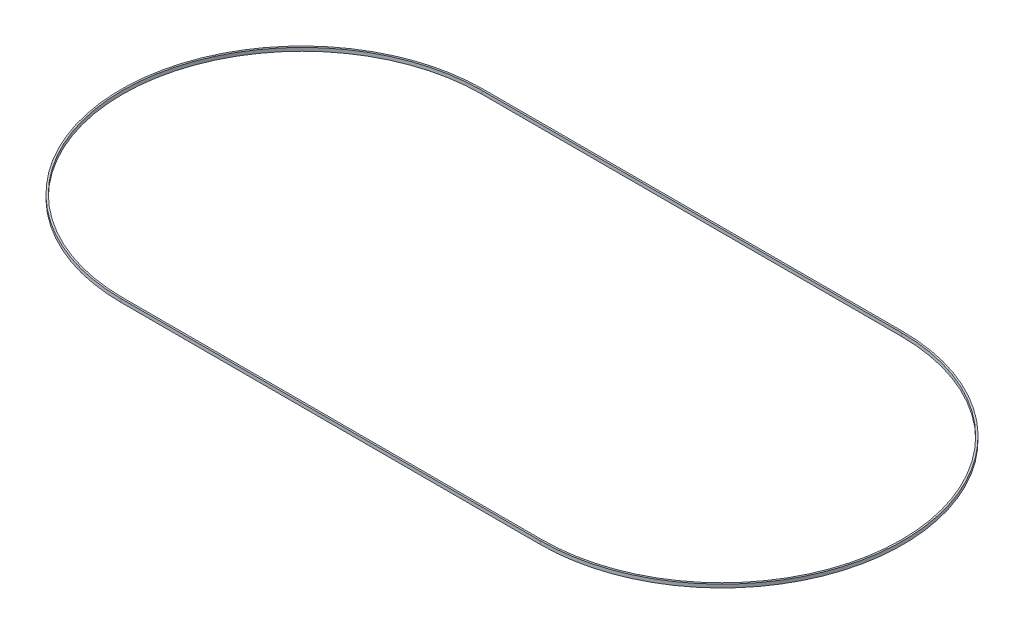
from build123d import *

# Parameters (mm, degrees)
BOSS_EXTRUDE2_DEPTH = 400


with BuildPart() as part:
    # Sketch1 → Boss-Extrude2 (new body)
    with BuildSketch(Plane(origin=(0, 0, 0), x_dir=(1, 0, 0), z_dir=(0, 1, 0))):
        with BuildLine():
            Line((-25000, -21600), (25000, -21600))
            ThreePointArc((25000, -21600), (46600, 0), (25000, 21600))
            Line((25000, 21600), (-25000, 21600))
            ThreePointArc((-25000, 21600), (-46600, 0), (-25000, -21600))
        make_face()
        with BuildLine():
            Line((-25000, -21400), (25000, -21400))
            ThreePointArc((25000, -21400), (46400, 0), (25000, 21400))
            Line((25000, 21400), (-25000, 21400))
            ThreePointArc((-25000, 21400), (-46400, 0), (-25000, -21400))
        make_face(mode=Mode.SUBTRACT)
    extrude(amount=BOSS_EXTRUDE2_DEPTH)


solid = part.part
